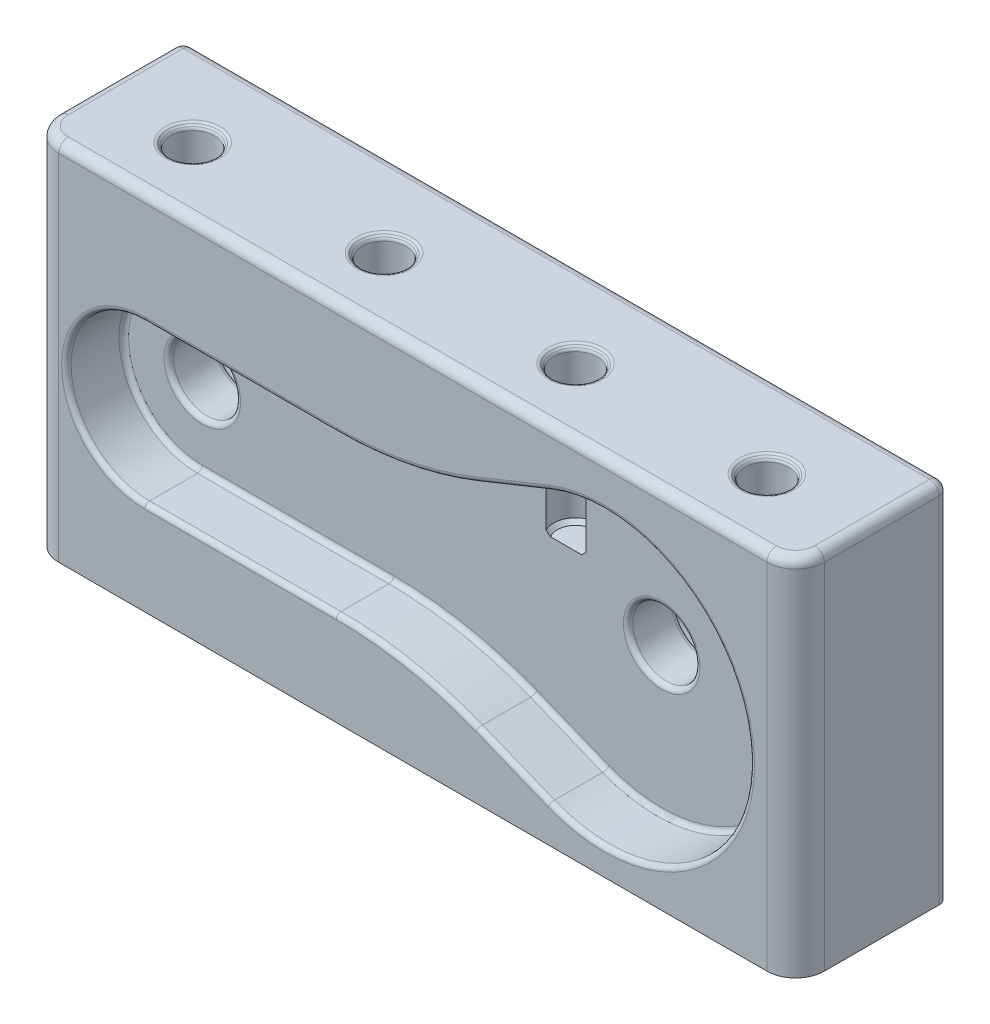
from build123d import *

# Parameters (mm, degrees)
SKETCH2_W           = 40
SKETCH2_H           = 19
BOSS_EXTRUDE1_DEPTH = 8
FILLET1_R           = 1.5
SKETCH5_R           = 1.15
CUT_EXTRUDE3_DEPTH  = 8
CHAMFER1_SIZE       = 0.2
FILLET3_R           = 0.2
FILLET2_R           = 0.5
SKETCH6_R           = 1.75
CUT_EXTRUDE4_DEPTH  = 24.542514734
SKETCH7_R           = 3
CUT_EXTRUDE5_DEPTH  = 2.5
CUT_EXTRUDE6_DEPTH  = 3
FILLET5_R           = 0.25
FILLET6_R           = 0.25


with BuildPart() as part:
    # Sketch2 → Boss-Extrude1 (new body)
    with BuildSketch(Plane.XY):
        Rectangle(SKETCH2_W, SKETCH2_H)
    extrude(amount=BOSS_EXTRUDE1_DEPTH)

    # Fillet1
    fillet1_edges = [part.edges().sort_by_distance(p)[0] for p in [
        (-20, 0, 8),
        (20, 0, 8),
    ]]
    fillet(fillet1_edges, radius=FILLET1_R)

    # Sketch5 → Cut-Extrude3 (cut)
    with BuildSketch(Plane(origin=(0, 9.5, 0), x_dir=(1, 0, 0), z_dir=(0, 1, 0))):
        with Locations(Location((-15, -4.5, 0), (0, 0, 270))):
            Circle(SKETCH5_R)
        with Locations(Location((-5, -4.5, 0), (0, 0, 270))):
            Circle(SKETCH5_R)
        with Locations(Location((5, -4.5, 0), (0, 0, 270))):
            Circle(SKETCH5_R)
        with Locations(Location((15, -4.5, 0), (0, 0, 270))):
            Circle(SKETCH5_R)
    extrude(amount=-CUT_EXTRUDE3_DEPTH, mode=Mode.SUBTRACT)

    # Chamfer1
    chamfer1_edges = [part.edges().sort_by_distance(p)[0] for p in [
        (-15, 1.5, 3.35),
        (-15, 9.5, 3.35),
        (-5, 1.5, 3.35),
        (-5, 9.5, 3.35),
        (5, 1.5, 3.35),
        (5, 9.5, 3.35),
        (15, 1.5, 3.35),
        (15, 9.5, 3.35),
    ]]
    chamfer(chamfer1_edges, length=CHAMFER1_SIZE)

    # Fillet3
    fillet3_edges = [part.edges().sort_by_distance(p)[0] for p in [
        (15, 9.3, 3.35),
        (-15, 9.5, 3.15),
        (-5, 9.5, 3.15),
        (5, 9.5, 3.15),
        (15, 9.5, 3.15),
        (5, 9.3, 3.35),
        (-5, 9.3, 3.35),
        (-15, 9.3, 3.35),
    ]]
    fillet(fillet3_edges, radius=FILLET3_R)

    # Fillet2
    fillet2_edges = [part.edges().sort_by_distance(p)[0] for p in [
        (0, 9.5, 8),
        (-20, 9.5, 3.25),
        (20, 9.5, 3.25),
        (-19.560660172, 9.5, 7.560660172),
        (19.560660172, 9.5, 7.560660172),
        (-20, 0, 0),
        (0, 9.5, 0),
        (20, 0, 0),
    ]]
    fillet(fillet2_edges, radius=FILLET2_R)

    # Sketch6 → Cut-Extrude4 (cut, through all)
    with BuildSketch(Plane.XY.offset(8)):
        with Locations((-14, -0.5)):
            Circle(SKETCH6_R)
        with Locations((10, -0.5)):
            Circle(SKETCH6_R)
    extrude(amount=-CUT_EXTRUDE4_DEPTH, mode=Mode.SUBTRACT)

    # Sketch7 → Cut-Extrude5 (cut)
    with BuildSketch(Plane(origin=(0, 0, 0), x_dir=(-1, 0, 0), z_dir=(0, 0, -1))):
        with Locations((-10, -0.5)):
            Circle(SKETCH7_R)
        with Locations((14, -0.5)):
            Circle(SKETCH7_R)
    extrude(amount=-CUT_EXTRUDE5_DEPTH, mode=Mode.SUBTRACT)

    # Sketch8 → Cut-Extrude6 (cut)
    with BuildSketch(Plane.XY.offset(8)):
        with BuildLine():
            Line((-14, -4.6), (-4, -4.6))
            ThreePointArc((-4, -4.6), (-0.232048588, -4.961827705), (3.398190783, -6.034086651))
            Line((3.398190783, -6.034086651), (7.160290407, -7.549542498))
            ThreePointArc((7.160290407, -7.549542498), (17.6, -0.5), (7.160290407, 6.549542498))
            Line((7.160290407, 6.549542498), (3.398190783, 5.034086651))
            ThreePointArc((3.398190783, 5.034086651), (-0.232048588, 3.961827705), (-4, 3.6))
            Line((-4, 3.6), (-14, 3.6))
            ThreePointArc((-14, 3.6), (-18.1, -0.5), (-14, -4.6))
        make_face()
    extrude(amount=-CUT_EXTRUDE6_DEPTH, mode=Mode.SUBTRACT)

    # Fillet5
    fillet5_edges = [part.edges().sort_by_distance(p)[0] for p in [
        (-11, -0.5, 0),
        (13, -0.5, 0),
        (-17.962434705, -1.553143488, 5),
        (-9, -4.6, 5),
        (-0.232048588, -4.961827705, 5),
        (5.279240595, -6.791814574, 5),
        (6.597953083, 6.323020749, 5),
        (5.279240595, -6.791814574, 8),
        (-0.232048588, -4.961827705, 8),
        (-9, -4.6, 8),
        (-18.1, -0.5, 8),
        (-9, 3.6, 8),
        (-0.232048588, 3.961827705, 8),
        (5.279240595, 5.791814574, 8),
        (16.048947293, -5.101112544, 5),
        (10.629406296, 7.073892507, 5),
        (17.6, -0.5, 8),
    ]]
    fillet(fillet5_edges, radius=FILLET5_R)

    # Fillet6
    fillet6_edges = [part.edges().sort_by_distance(p)[0] for p in [
        (8.25, -0.5, 2.5),
        (-15.75, -0.5, 2.5),
        (-15.75, -0.5, 5),
        (8.25, -0.5, 5),
    ]]
    fillet(fillet6_edges, radius=FILLET6_R)


solid = part.part
